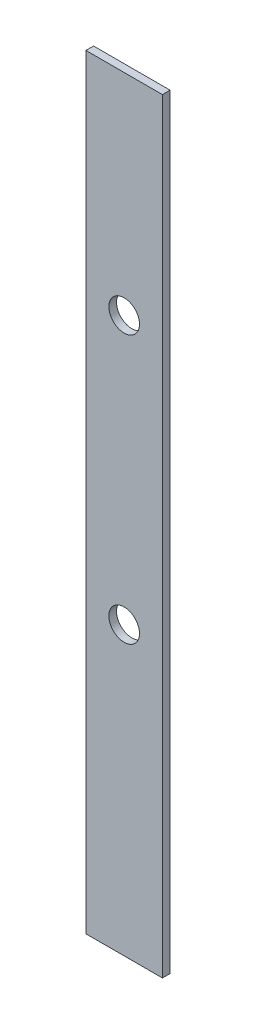
from build123d import *

# Parameters (mm, degrees)
BOSS_EXTRUDE1_DEPTH = 4
SKETCH3_R           = 8
BOSS_EXTRUDE2_DEPTH = 4
SKETCH3_2_R         = 8
CUT_EXTRUDE1_DEPTH  = 4


with BuildPart() as part:
    # Sketch1 → Boss-Extrude1 (new body)
    with BuildSketch(Plane.XY):
        Polygon((-20, 140), (-20, -140), (-20, -200), (20, -200), (20, -140), (20, 140), (20, 200), (-20, 200), align=None)
    extrude(amount=BOSS_EXTRUDE1_DEPTH)

    # Sketch3 → Boss-Extrude2 (add)
    with BuildSketch(Plane(origin=(0, 0, 0), x_dir=(-1, 0, 0), z_dir=(0, 0, -1))):
        with Locations((0, 90)):
            Circle(SKETCH3_R)
        with Locations((0, -50)):
            Circle(SKETCH3_R)
    extrude(amount=-BOSS_EXTRUDE2_DEPTH)

    # Sketch3<2> → Cut-Extrude1 (cut)
    with BuildSketch(Plane(origin=(0, 0, 0), x_dir=(-1, 0, 0), z_dir=(0, 0, -1))):
        with Locations((0, 90)):
            Circle(SKETCH3_2_R)
        with Locations((0, -50)):
            Circle(SKETCH3_2_R)
    extrude(amount=-CUT_EXTRUDE1_DEPTH, mode=Mode.SUBTRACT)


solid = part.part
